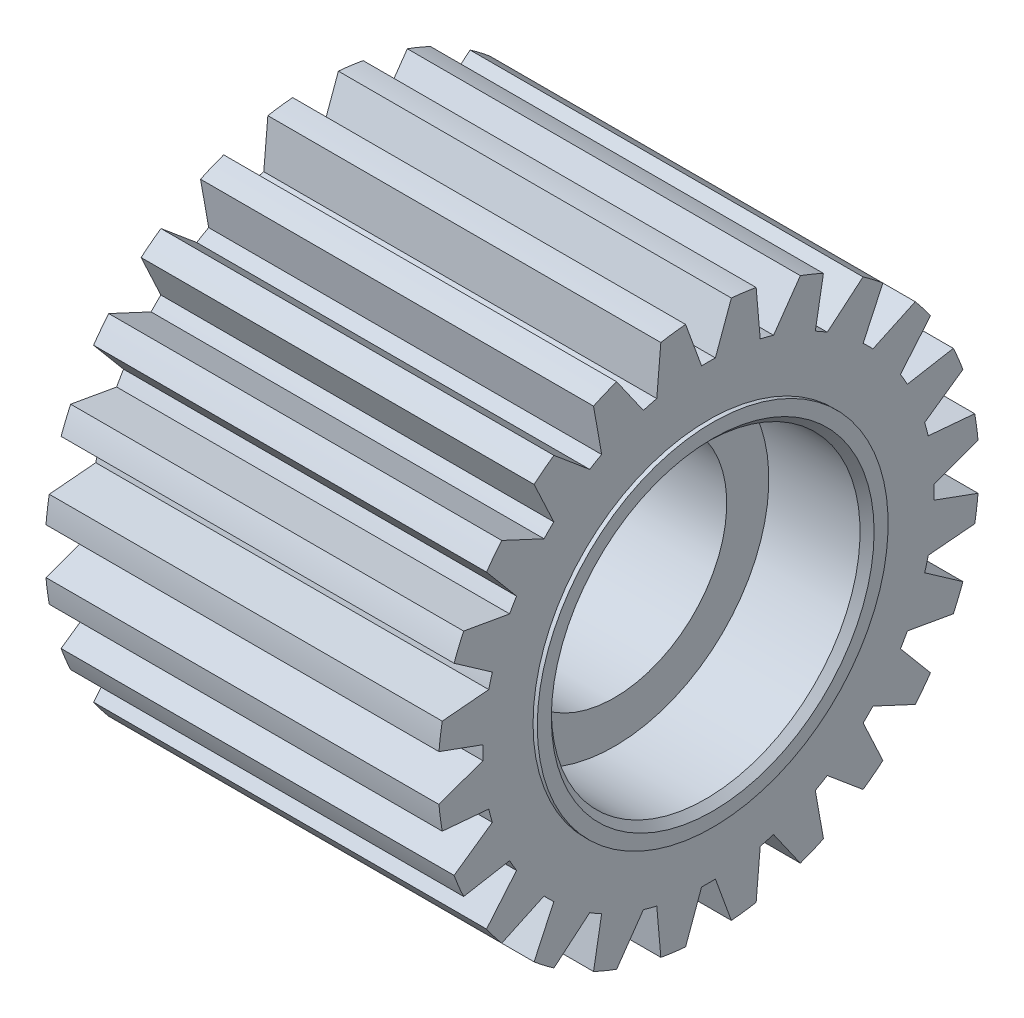
from build123d import *

# Parameters (mm, degrees)
SCHNITT_LINEAR_AUSTRAGEN1_REACH = 41.29
KREISMUSTER1_COUNT              = 24


with BuildPart() as part:
    # Skizze1 → Rotation1 (revolve)
    with BuildSketch(Plane.XY):
        Polygon((-14.3, 12.5), (-14.3, 11.5), (-13.8, 11), (-7.3, 11), (-7.3, 8), (7.3, 8), (7.3, 11), (13.8, 11), (14.3, 11.5), (14.3, 12.5), (14, 12.5), (14, 19.2715), (-14, 19.2715), (-14, 12.5), align=None)
    revolve(axis=Axis((-36.010442658, 0, 0), (1, 0, 0)))

    # Skizze2 → Schnitt-Linear austragen1 (cut, up to next)
    with BuildSketch(Plane(origin=(14, 0, 0), x_dir=(0, 0, -1), z_dir=(1, 0, 0)), mode=Mode.PRIVATE) as schnitt_linear_austragen1_sk1:
        with BuildLine():
            Line((0.491939129, 16.076475108), (1.629707388, 19.202467708))
            ThreePointArc((1.629707388, 19.202467708), (0, 19.2715), (-1.629707388, 19.202467708))
            Line((-1.629707388, 19.202467708), (-0.491939129, 16.076475108))
            ThreePointArc((-0.491939129, 16.076475108), (0, 16.084), (0.491939129, 16.076475108))
        make_face()
    schnitt_linear_austragen1_tool1 = extrude(schnitt_linear_austragen1_sk1.sketch, amount=-SCHNITT_LINEAR_AUSTRAGEN1_REACH, mode=Mode.PRIVATE) & part.part
    schnitt_linear_austragen1 = schnitt_linear_austragen1_tool1.solids().sort_by_distance((14, 17.949237, 0))[0]
    add(schnitt_linear_austragen1, mode=Mode.SUBTRACT)

    # Kreismuster1: Schnitt-Linear austragen1 ×24 about axis
    kreismuster1_axis = Axis((-15.73, 0, 0), (1, 0, 0))
    for i in range(1, KREISMUSTER1_COUNT):
        add(schnitt_linear_austragen1.rotate(kreismuster1_axis, i * 360 / KREISMUSTER1_COUNT), mode=Mode.SUBTRACT)


solid = part.part
